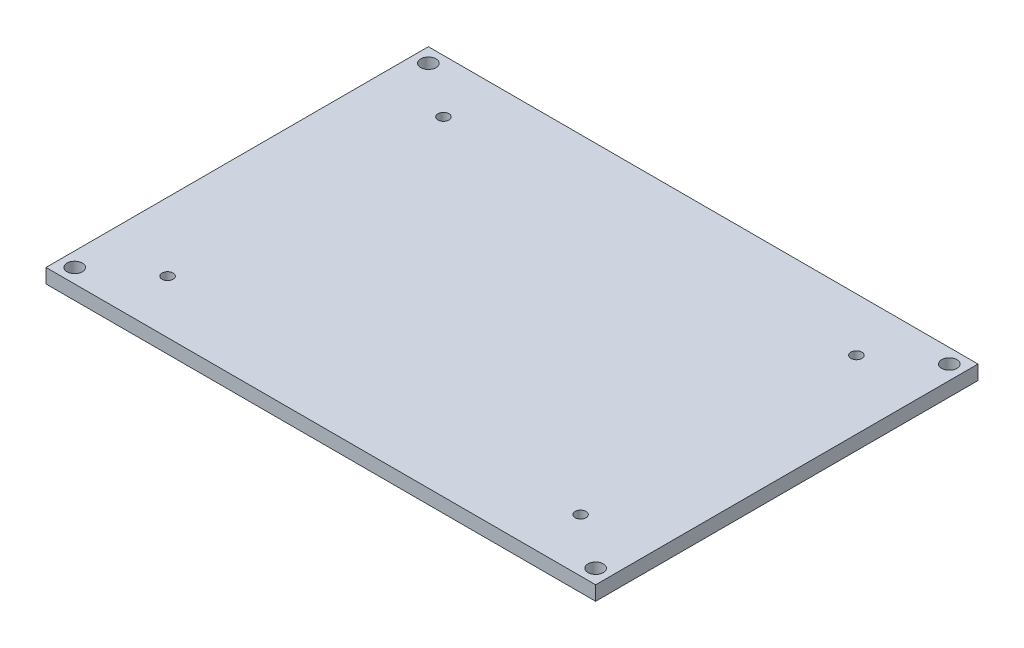
from build123d import *

# Parameters (mm, degrees)
SKETCH_1_W      = 115
SKETCH_1_H      = 80
SKETCH_1_R      = 1.15
SKETCH_1_R_2    = 1.6
EXTRUDE_1_DEPTH = 3


with BuildPart() as part:
    # 草图1 → 凸台-拉伸1 (new body)
    with BuildSketch(Plane(origin=(0, 0, 0), x_dir=(1, 0, 0), z_dir=(0, 1, 0))):
        Rectangle(SKETCH_1_W, SKETCH_1_H)
        with Locations(Location((-43.2, 28.86, 0), (0, 0, 270))):
            Circle(SKETCH_1_R, mode=Mode.SUBTRACT)
        with Locations(Location((43.2, 28.86, 0), (0, 0, 90))):
            Circle(SKETCH_1_R, mode=Mode.SUBTRACT)
        with Locations(Location((43.2, -28.86, 0), (0, 0, 270))):
            Circle(SKETCH_1_R, mode=Mode.SUBTRACT)
        with Locations(Location((-43.2, -28.86, 0), (0, 0, 90))):
            Circle(SKETCH_1_R, mode=Mode.SUBTRACT)
        with Locations(Location((-54.5, 37, 0), (0, 0, 270))):
            Circle(SKETCH_1_R_2, mode=Mode.SUBTRACT)
        with Locations(Location((54.5, 37, 0), (0, 0, 90))):
            Circle(SKETCH_1_R_2, mode=Mode.SUBTRACT)
        with Locations(Location((-54.5, -37, 0), (0, 0, 90))):
            Circle(SKETCH_1_R_2, mode=Mode.SUBTRACT)
        with Locations(Location((54.5, -37, 0), (0, 0, 270))):
            Circle(SKETCH_1_R_2, mode=Mode.SUBTRACT)
    extrude(amount=EXTRUDE_1_DEPTH)


solid = part.part
